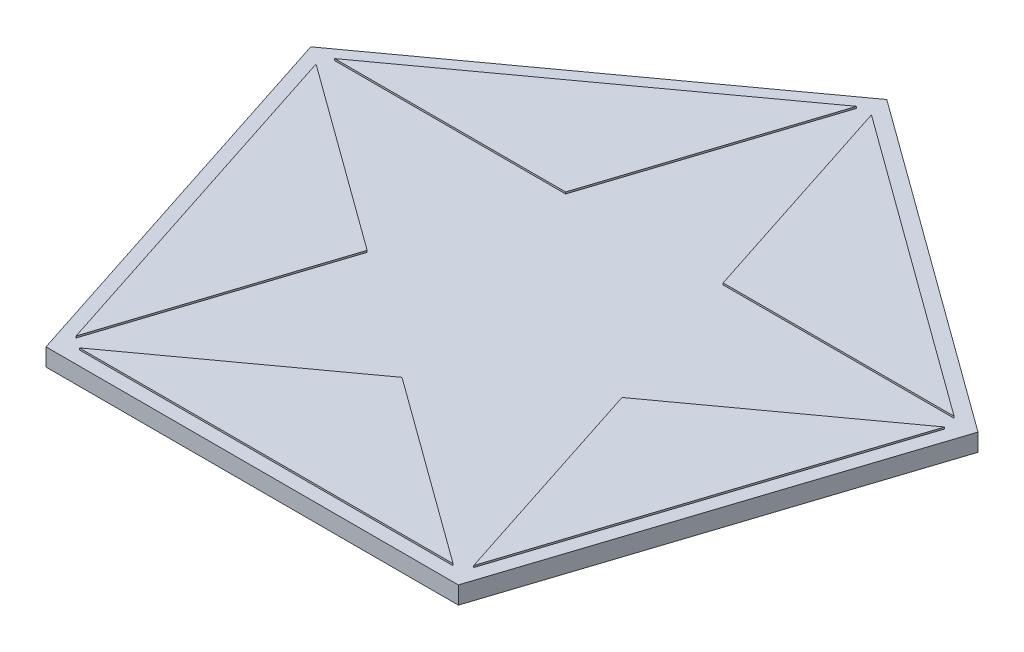
from build123d import *

# Parameters (mm, degrees)
BOSS_EXTRUDE1_DEPTH = 0.25
BOSS_EXTRUDE2_DEPTH = 0.05


with BuildPart() as part:
    # Sketch1 → Boss-Extrude1 (new, symmetric)
    with BuildSketch(Plane(origin=(0, 0, 0), x_dir=(1, 0, 0), z_dir=(0, 1, 0))):
        Polygon((-5.877852523, -8.090169944), (5.877852523, -8.090169944), (9.510565163, 3.090169944), (0, 10), (-9.510565163, 3.090169944), align=None)
        Polygon((-5.667560078, -7.442956348), (-8.960012395, 2.690169944), (-3.63271264, -1.180339887), align=None, mode=Mode.SUBTRACT)
        Polygon((5.327299755, -7.690169944), (-5.327299755, -7.690169944), (0, -3.819660113), align=None, mode=Mode.SUBTRACT)
        Polygon((8.960012395, 2.690169944), (5.667560078, -7.442956348), (3.63271264, -1.180339887), align=None, mode=Mode.SUBTRACT)
        Polygon((-8.830044516, 3.090169944), (-0.210292445, 9.352786405), (-2.245139883, 3.090169944), align=None, mode=Mode.SUBTRACT)
        Polygon((0.210292445, 9.352786405), (8.830044516, 3.090169944), (2.245139883, 3.090169944), align=None, mode=Mode.SUBTRACT)
    extrude(amount=BOSS_EXTRUDE1_DEPTH, both=True)

    # Sketch2 → Boss-Extrude2 (add, symmetric)
    with BuildSketch(Plane(origin=(0, 0.25, 0), x_dir=(1, 0, 0), z_dir=(0, 1, 0))):
        Polygon((-2.245139883, 3.090169944), (-8.830044516, 3.090169944), (-0.210292445, 9.352786405), align=None)
        Polygon((-8.960012395, 2.690169944), (-3.63271264, -1.180339887), (-5.667560078, -7.442956348), align=None)
        Polygon((-5.327299755, -7.690169944), (0, -3.819660113), (5.327299755, -7.690169944), align=None)
        Polygon((8.960012395, 2.690169944), (5.667560078, -7.442956348), (3.63271264, -1.180339887), align=None)
        Polygon((8.830044516, 3.090169944), (2.245139883, 3.090169944), (0.210292445, 9.352786405), align=None)
    extrude(amount=BOSS_EXTRUDE2_DEPTH, both=True)


solid = part.part
